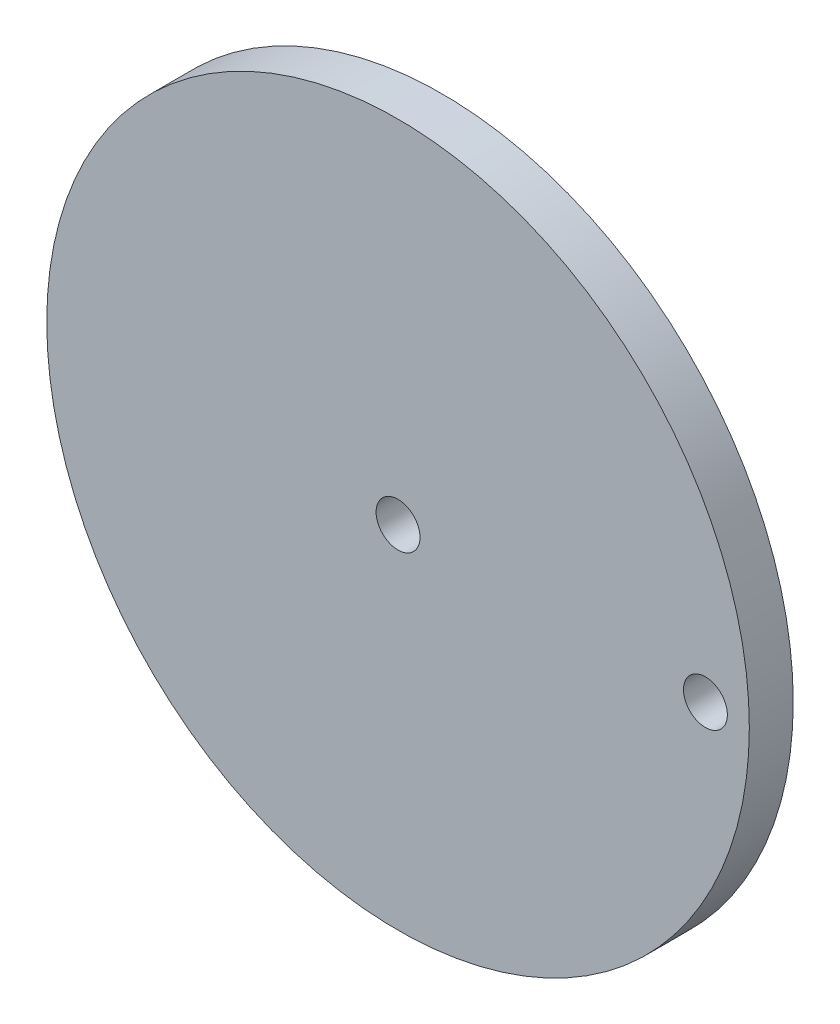
from build123d import *

# Parameters (mm, degrees)
SKETCH_1_R      = 5
SKETCH_1_R_2    = 2.5
EXTRUDE_1_DEPTH = 5
EXTRUDE_START   = -5
SKETCH_2_R      = 40
SKETCH_2_R_2    = 2.5
EXTRUDE_2_DEPTH = 5


with BuildPart() as part:
    # 草图1 → 凸台-拉伸1 (new body)
    # profile 1 of 3: a face of its own
    with BuildSketch(Plane.XY):
        with BuildLine():
            ThreePointArc((5, 0), (3.535533906, -3.535533906), (0, -5))
            Line((0, -5), (35, -5))
            ThreePointArc((35, -5), (30, 0), (35, 5))
            Line((35, 5), (0, 5))
            ThreePointArc((0, 5), (3.535533906, 3.535533906), (5, 0))
        make_face()
    # profile 2 of 3: a face of its own
    with BuildSketch(Plane.XY):
        Circle(SKETCH_1_R)
        Circle(SKETCH_1_R_2, mode=Mode.SUBTRACT)
    # profile 3 of 3: a face of its own
    with BuildSketch(Plane.XY):
        with Locations((35, 0)):
            Circle(SKETCH_1_R)
        with Locations((35, 0)):
            Circle(SKETCH_1_R_2, mode=Mode.SUBTRACT)
    extrude(amount=EXTRUDE_1_DEPTH)

    # 草图2 → 凸台-拉伸2 (add)
    with BuildSketch(Plane.XY.offset(5).offset(EXTRUDE_START)):
        Circle(SKETCH_2_R)
        Circle(SKETCH_2_R_2, mode=Mode.SUBTRACT)
        with Locations((35, 0)):
            Circle(SKETCH_2_R_2, mode=Mode.SUBTRACT)
    extrude(amount=EXTRUDE_2_DEPTH)


solid = part.part
